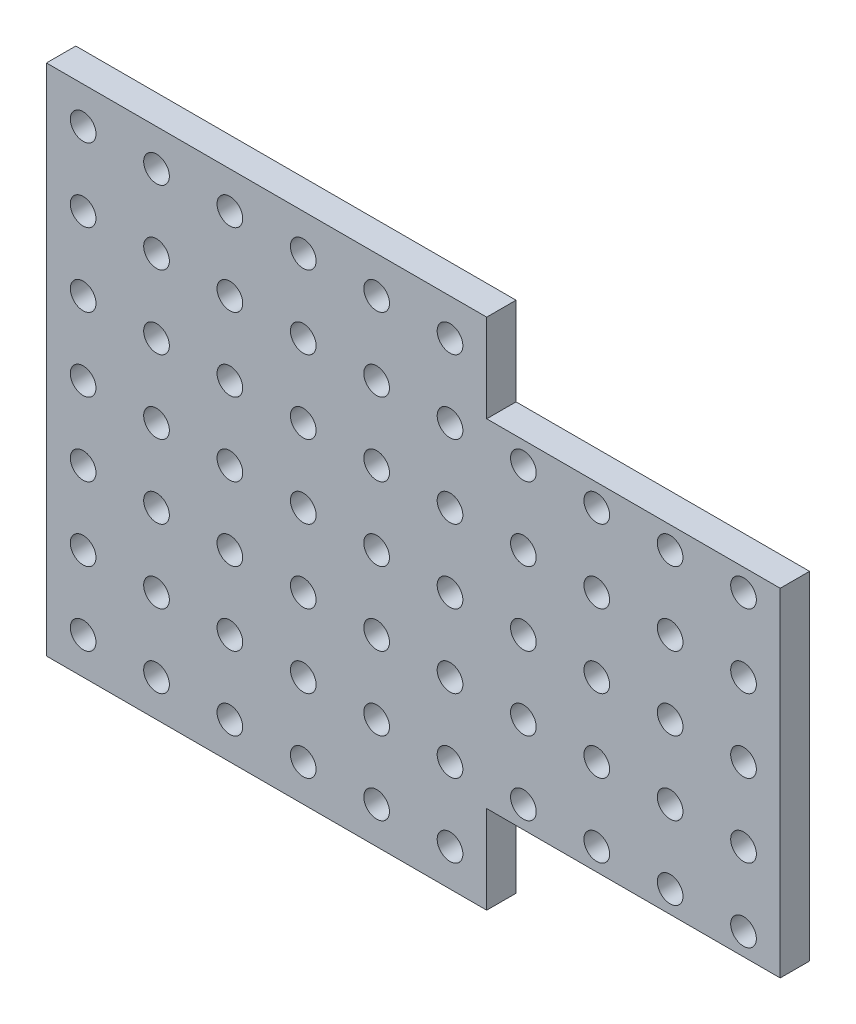
from build123d import *

# Parameters (mm, degrees)
ESQUISSE1_R        = 1.75
BOSS_EXTRU_1_DEPTH = 4


with BuildPart() as part:
    # Esquisse1 → Boss.-Extru.1 (new body)
    with BuildSketch(Plane.XY):
        Polygon((0, 0), (0, 70), (60, 70), (60, 58), (100, 58), (100, 12), (60, 12), (60, 0), align=None)
        with Locations((5, 5)):
            Circle(ESQUISSE1_R, mode=Mode.SUBTRACT)
        with Locations((15, 5)):
            Circle(ESQUISSE1_R, mode=Mode.SUBTRACT)
        with Locations((25, 5)):
            Circle(ESQUISSE1_R, mode=Mode.SUBTRACT)
        with Locations((35, 5)):
            Circle(ESQUISSE1_R, mode=Mode.SUBTRACT)
        with Locations((45, 5)):
            Circle(ESQUISSE1_R, mode=Mode.SUBTRACT)
        with Locations((55, 5)):
            Circle(ESQUISSE1_R, mode=Mode.SUBTRACT)
        with Locations((15, 15)):
            Circle(ESQUISSE1_R, mode=Mode.SUBTRACT)
        with Locations((25, 15)):
            Circle(ESQUISSE1_R, mode=Mode.SUBTRACT)
        with Locations((35, 15)):
            Circle(ESQUISSE1_R, mode=Mode.SUBTRACT)
        with Locations((45, 15)):
            Circle(ESQUISSE1_R, mode=Mode.SUBTRACT)
        with Locations((55, 15)):
            Circle(ESQUISSE1_R, mode=Mode.SUBTRACT)
        with Locations((65, 15)):
            Circle(ESQUISSE1_R, mode=Mode.SUBTRACT)
        with Locations((75, 15)):
            Circle(ESQUISSE1_R, mode=Mode.SUBTRACT)
        with Locations((85, 15)):
            Circle(ESQUISSE1_R, mode=Mode.SUBTRACT)
        with Locations((95, 15)):
            Circle(ESQUISSE1_R, mode=Mode.SUBTRACT)
        with Locations((15, 25)):
            Circle(ESQUISSE1_R, mode=Mode.SUBTRACT)
        with Locations((25, 25)):
            Circle(ESQUISSE1_R, mode=Mode.SUBTRACT)
        with Locations((35, 25)):
            Circle(ESQUISSE1_R, mode=Mode.SUBTRACT)
        with Locations((45, 25)):
            Circle(ESQUISSE1_R, mode=Mode.SUBTRACT)
        with Locations((55, 25)):
            Circle(ESQUISSE1_R, mode=Mode.SUBTRACT)
        with Locations((65, 25)):
            Circle(ESQUISSE1_R, mode=Mode.SUBTRACT)
        with Locations((75, 25)):
            Circle(ESQUISSE1_R, mode=Mode.SUBTRACT)
        with Locations((85, 25)):
            Circle(ESQUISSE1_R, mode=Mode.SUBTRACT)
        with Locations((95, 25)):
            Circle(ESQUISSE1_R, mode=Mode.SUBTRACT)
        with Locations((15, 35)):
            Circle(ESQUISSE1_R, mode=Mode.SUBTRACT)
        with Locations((25, 35)):
            Circle(ESQUISSE1_R, mode=Mode.SUBTRACT)
        with Locations((35, 35)):
            Circle(ESQUISSE1_R, mode=Mode.SUBTRACT)
        with Locations((45, 35)):
            Circle(ESQUISSE1_R, mode=Mode.SUBTRACT)
        with Locations((55, 35)):
            Circle(ESQUISSE1_R, mode=Mode.SUBTRACT)
        with Locations((65, 35)):
            Circle(ESQUISSE1_R, mode=Mode.SUBTRACT)
        with Locations((75, 35)):
            Circle(ESQUISSE1_R, mode=Mode.SUBTRACT)
        with Locations((85, 35)):
            Circle(ESQUISSE1_R, mode=Mode.SUBTRACT)
        with Locations((95, 35)):
            Circle(ESQUISSE1_R, mode=Mode.SUBTRACT)
        with Locations((15, 45)):
            Circle(ESQUISSE1_R, mode=Mode.SUBTRACT)
        with Locations((25, 45)):
            Circle(ESQUISSE1_R, mode=Mode.SUBTRACT)
        with Locations((35, 45)):
            Circle(ESQUISSE1_R, mode=Mode.SUBTRACT)
        with Locations((45, 45)):
            Circle(ESQUISSE1_R, mode=Mode.SUBTRACT)
        with Locations((55, 45)):
            Circle(ESQUISSE1_R, mode=Mode.SUBTRACT)
        with Locations((65, 45)):
            Circle(ESQUISSE1_R, mode=Mode.SUBTRACT)
        with Locations((75, 45)):
            Circle(ESQUISSE1_R, mode=Mode.SUBTRACT)
        with Locations((85, 45)):
            Circle(ESQUISSE1_R, mode=Mode.SUBTRACT)
        with Locations((95, 45)):
            Circle(ESQUISSE1_R, mode=Mode.SUBTRACT)
        with Locations((15, 55)):
            Circle(ESQUISSE1_R, mode=Mode.SUBTRACT)
        with Locations((25, 55)):
            Circle(ESQUISSE1_R, mode=Mode.SUBTRACT)
        with Locations((35, 55)):
            Circle(ESQUISSE1_R, mode=Mode.SUBTRACT)
        with Locations((45, 55)):
            Circle(ESQUISSE1_R, mode=Mode.SUBTRACT)
        with Locations((55, 55)):
            Circle(ESQUISSE1_R, mode=Mode.SUBTRACT)
        with Locations((65, 55)):
            Circle(ESQUISSE1_R, mode=Mode.SUBTRACT)
        with Locations((75, 55)):
            Circle(ESQUISSE1_R, mode=Mode.SUBTRACT)
        with Locations((85, 55)):
            Circle(ESQUISSE1_R, mode=Mode.SUBTRACT)
        with Locations((95, 55)):
            Circle(ESQUISSE1_R, mode=Mode.SUBTRACT)
        with Locations((15, 65)):
            Circle(ESQUISSE1_R, mode=Mode.SUBTRACT)
        with Locations((25, 65)):
            Circle(ESQUISSE1_R, mode=Mode.SUBTRACT)
        with Locations((35, 65)):
            Circle(ESQUISSE1_R, mode=Mode.SUBTRACT)
        with Locations((45, 65)):
            Circle(ESQUISSE1_R, mode=Mode.SUBTRACT)
        with Locations((55, 65)):
            Circle(ESQUISSE1_R, mode=Mode.SUBTRACT)
        with Locations((5, 15)):
            Circle(ESQUISSE1_R, mode=Mode.SUBTRACT)
        with Locations((5, 25)):
            Circle(ESQUISSE1_R, mode=Mode.SUBTRACT)
        with Locations((5, 35)):
            Circle(ESQUISSE1_R, mode=Mode.SUBTRACT)
        with Locations((5, 45)):
            Circle(ESQUISSE1_R, mode=Mode.SUBTRACT)
        with Locations((5, 55)):
            Circle(ESQUISSE1_R, mode=Mode.SUBTRACT)
        with Locations((5, 65)):
            Circle(ESQUISSE1_R, mode=Mode.SUBTRACT)
    extrude(amount=BOSS_EXTRU_1_DEPTH)


solid = part.part
